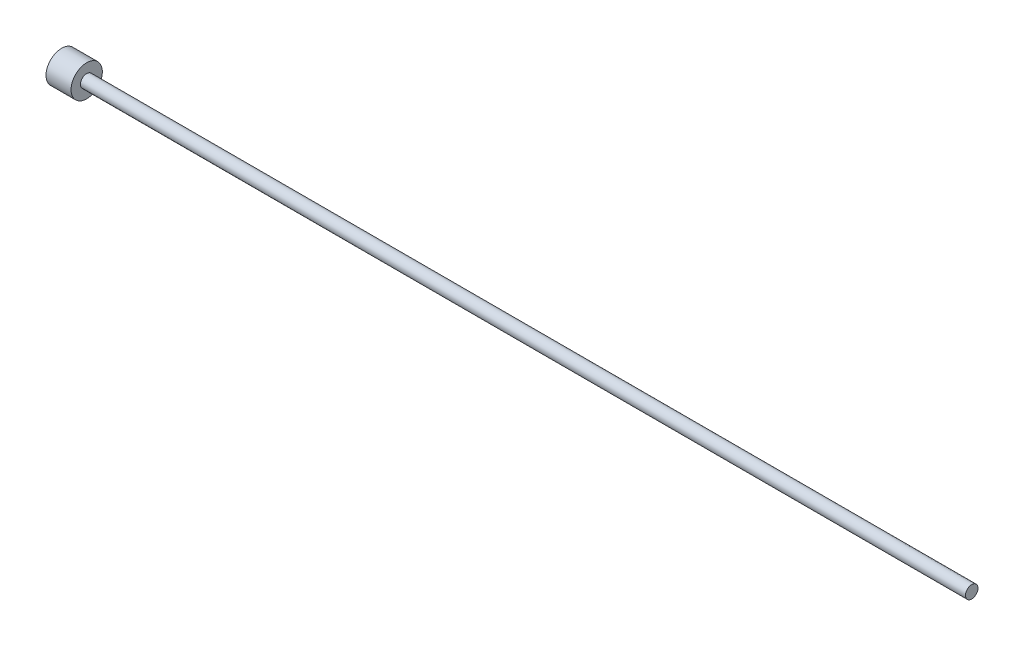
from build123d import *


with BuildPart() as part:
    # 草图1 → 旋转1 (revolve)
    with BuildSketch(Plane(origin=(0, 0, 0), x_dir=(1, 0, 0), z_dir=(0, 1, 0)), mode=Mode.PRIVATE) as revolve_1_sk:
        Polygon((0, 0), (0, 12.5), (20, 12.5), (20, 5), (727, 5), (727, 0), align=None)
    revolve(revolve_1_sk.sketch.rotate(Axis((0, 0, 0), (1, 0, 0)), 180), axis=Axis((0, 0, 0), (1, 0, 0)))


solid = part.part
